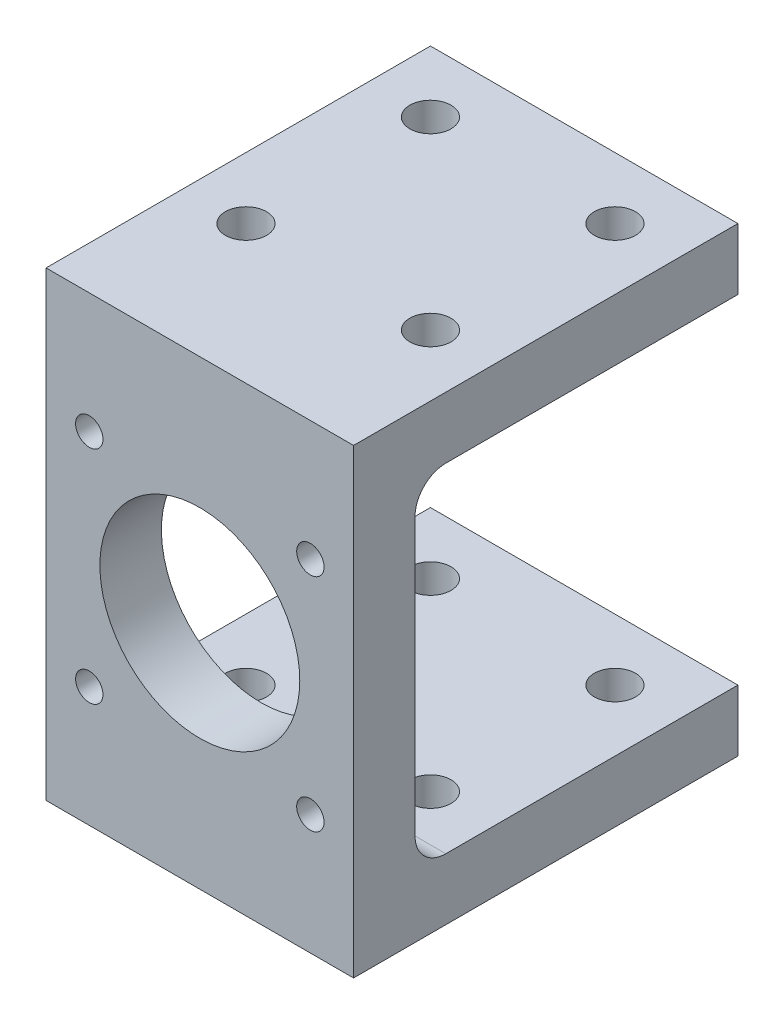
from build123d import *

# Parameters (mm, degrees)
SKETCH1_W               = 25.4
SKETCH1_H               = 38.1
SKETCH1_R               = 8.255
SKETCH1_R_2             = 1.1303
BOSS_EXTRUDE1_DEPTH     = 15.875
CUT_EXTRUDE1_REACH      = 37.498
SKETCH3_W               = 26.67
SKETCH3_H               = 27.94
FILLET1_R               = 2.54
SKETCH5_R               = 1.7
FRAME_MOUNT_HOLES_DEPTH = 44.184668865


with BuildPart() as part:
    # Sketch1 → Boss-Extrude1 (new, symmetric)
    with BuildSketch(Plane.XY):
        Rectangle(SKETCH1_W, SKETCH1_H)
        Circle(SKETCH1_R, mode=Mode.SUBTRACT)
        with Locations((-9.1313, 9.1313)):
            Circle(SKETCH1_R_2, mode=Mode.SUBTRACT)
        with Locations((9.1313, 9.1313)):
            Circle(SKETCH1_R_2, mode=Mode.SUBTRACT)
        with Locations((-9.1313, -9.1313)):
            Circle(SKETCH1_R_2, mode=Mode.SUBTRACT)
        with Locations((9.1313, -9.1313)):
            Circle(SKETCH1_R_2, mode=Mode.SUBTRACT)
    extrude(amount=BOSS_EXTRUDE1_DEPTH, both=True)

    # Sketch3 → Cut-Extrude1 (cut, up to next)
    with BuildSketch(Plane(origin=(12.7, 0, 0), x_dir=(0, 0, -1), z_dir=(1, 0, 0)), mode=Mode.PRIVATE) as cut_extrude1_sk1:
        with Locations((2.54, 0)):
            Rectangle(SKETCH3_W, SKETCH3_H)
    cut_extrude1_tool1 = extrude(cut_extrude1_sk1.sketch, amount=-CUT_EXTRUDE1_REACH, mode=Mode.PRIVATE) & part.part
    add(cut_extrude1_tool1.solids().sort_by_distance((12.7, 0, -2.54))[0], mode=Mode.SUBTRACT)

    # Fillet1
    fillet1_edges = [part.edges().sort_by_distance(p)[0] for p in [
        (0, -13.97, 10.795),
        (0, 13.97, 10.795),
    ]]
    fillet(fillet1_edges, radius=FILLET1_R)

    # Sketch5 → Frame Mount Holes (cut, through all)
    with BuildSketch(Plane(origin=(0, 19.05, 0), x_dir=(1, 0, 0), z_dir=(0, 1, 0))):
        with Locations(Location((-7.62, 10.795, 0), (0, 0, 270))):
            Circle(SKETCH5_R)
        with Locations(Location((-7.62, -4.445, 0), (0, 0, 270))):
            Circle(SKETCH5_R)
        with Locations(Location((7.62, -4.445, 0), (0, 0, 270))):
            Circle(SKETCH5_R)
        with Locations(Location((7.62, 10.795, 0), (0, 0, 270))):
            Circle(SKETCH5_R)
    extrude(amount=-FRAME_MOUNT_HOLES_DEPTH, mode=Mode.SUBTRACT)


solid = part.part
